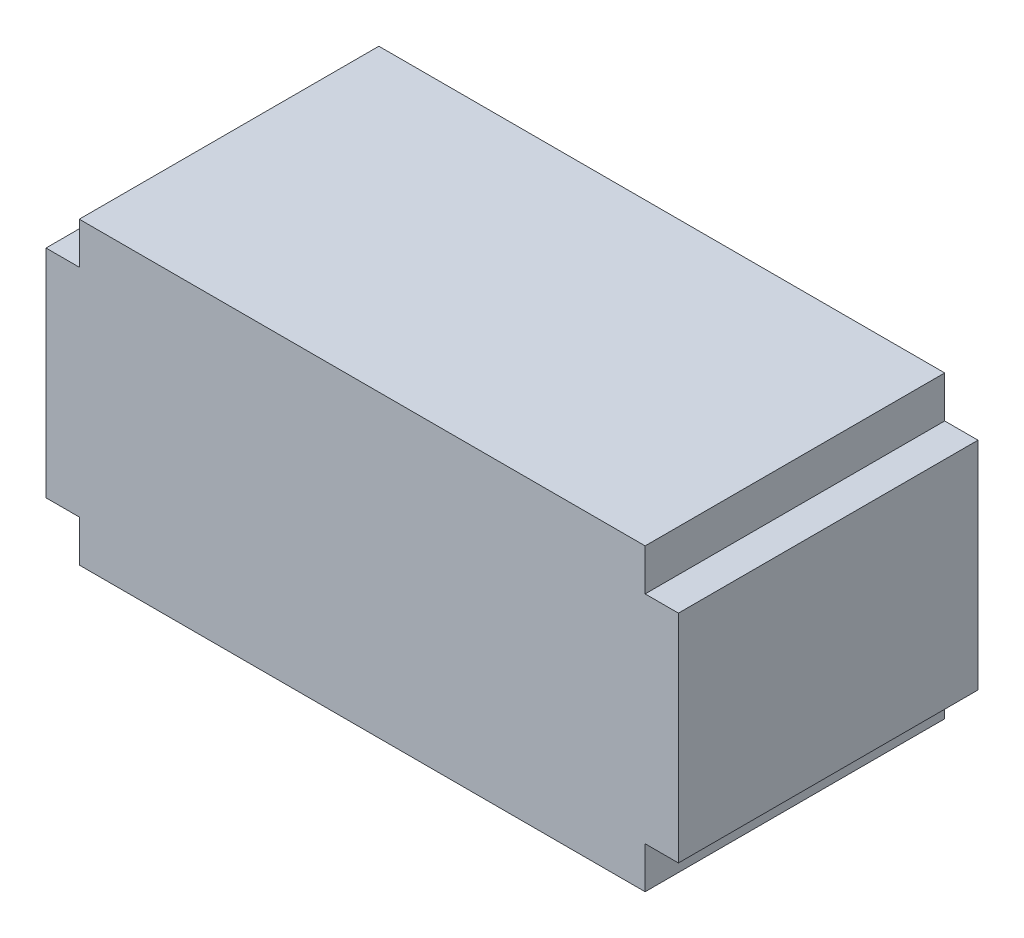
from build123d import *

# Parameters (mm, degrees)
COMPONENT_OUTLINE_DEPTH = 1.8


with BuildPart() as part:
    # 草图1 → Component_Outline (new body)
    with BuildSketch(Plane.XY):
        Polygon((-1.7, -0.9), (-1.7, -0.65), (-1.9, -0.65), (-1.9, 0.65), (-1.7, 0.65), (-1.7, 0.9), (1.7, 0.9), (1.7, 0.65), (1.9, 0.65), (1.9, -0.65), (1.7, -0.65), (1.7, -0.9), align=None)
    extrude(amount=COMPONENT_OUTLINE_DEPTH)


solid = part.part
